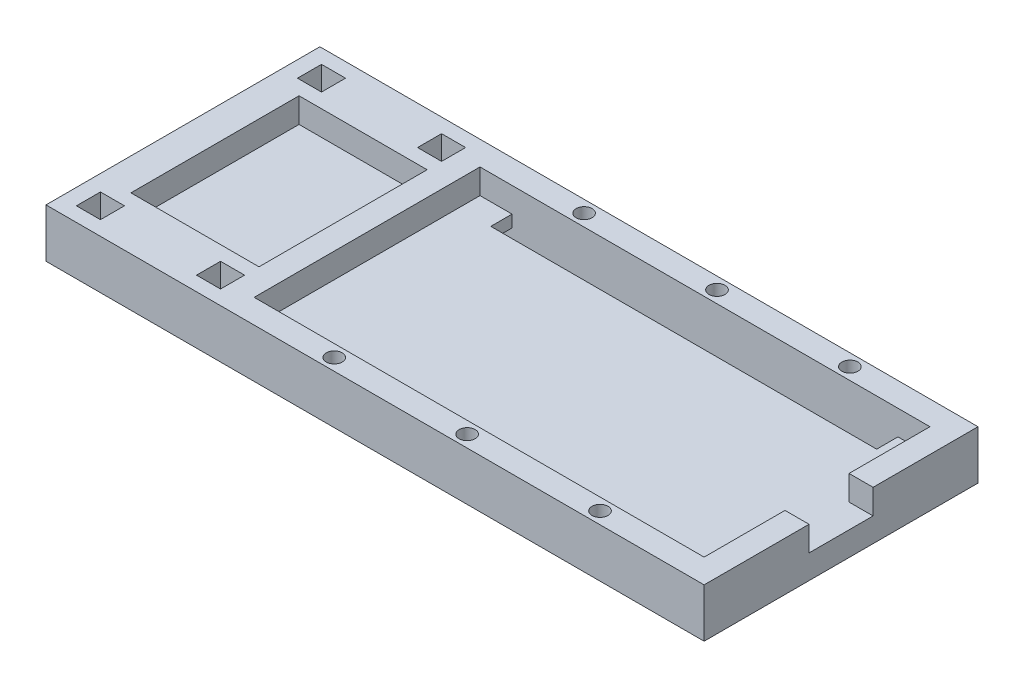
from build123d import *

# Parameters (mm, degrees)
SKETCH1_W            = 46.4
SKETCH1_H            = 24.75
BOSS_EXTRUDE1_DEPTH  = 5.9
BOSS_EXTRUDE2_DEPTH  = 2.5
SKETCH3_W            = 50
SKETCH3_H            = 50
BOSS_EXTRUDE3_DEPTH  = 2.5
SKETCH4_W            = 46.4
SKETCH4_H            = 0.93
BOSS_EXTRUDE4_DEPTH  = 5.9
SKETCH5_W            = 46.4
SKETCH5_H            = 0.93
BOSS_EXTRUDE5_DEPTH  = 5.9
SKETCH6_W            = 46.4
SKETCH6_H            = 3
BOSS_EXTRUDE6_DEPTH  = 8.4
SKETCH7_W            = 46.4
SKETCH7_H            = 3
BOSS_EXTRUDE7_DEPTH  = 8.4
SKETCH8_W            = 46.4
SKETCH8_H            = 22.9
BOSS_EXTRUDE8_DEPTH  = 8.4
SKETCH9_W            = 46.4
SKETCH9_H            = 3
BOSS_EXTRUDE9_DEPTH  = 8.4
SKETCH10_W           = 22.9
SKETCH10_H           = 10.9
BOSS_EXTRUDE10_DEPTH = 1.8
SKETCH11_W           = 0.93
SKETCH11_H           = 5.9
BOSS_EXTRUDE11_DEPTH = 1.8
SKETCH12_W           = 32.7
SKETCH12_H           = 0.925
SKETCH12_H_2         = 0.93
BOSS_EXTRUDE12_DEPTH = 8.4
SKETCH13_W           = 0.93
SKETCH13_H           = 5.9
BOSS_EXTRUDE13_DEPTH = 1.8
SKETCH14_W           = 48.2
SKETCH14_H           = 3
BOSS_EXTRUDE14_DEPTH = 8.4
SKETCH15_W           = 32.7
SKETCH15_H           = 0.93
SKETCH15_H_2         = 0.925
BOSS_EXTRUDE15_DEPTH = 8.4
SKETCH16_W           = 0.35
SKETCH16_H           = 5.9
CUT_EXTRUDE1_DEPTH   = 59.371568422
SKETCH18_W           = 0.35
SKETCH18_H           = 5.9
CUT_EXTRUDE2_DEPTH   = 59.371568422
SKETCH20_W           = 22.9
SKETCH20_H           = 2.5
BOSS_EXTRUDE17_DEPTH = 4
SKETCH22_W           = 22.9
SKETCH22_H           = 2.5
BOSS_EXTRUDE19_DEPTH = 3
SKETCH23_W           = 3
SKETCH23_H           = 22.9
BOSS_EXTRUDE20_DEPTH = 1.5
SKETCH24_W           = 22.9
SKETCH24_H           = 2.5
BOSS_EXTRUDE21_DEPTH = 7
SKETCH25_W           = 3
SKETCH25_H           = 22.9
BOSS_EXTRUDE22_DEPTH = 3
SKETCH27_W           = 48.2
SKETCH27_H           = 3
BOSS_EXTRUDE23_DEPTH = 7
SKETCH28_W           = 56.2
SKETCH28_H           = 22.9
BOSS_EXTRUDE24_DEPTH = 7
SKETCH29_W           = 3
SKETCH29_H           = 22.9
BOSS_EXTRUDE25_DEPTH = 7
SKETCH30_W           = 3
SKETCH30_H           = 22.9
BOSS_EXTRUDE26_DEPTH = 7
SKETCH31_W           = 7
SKETCH31_H           = 6.5
CUT_EXTRUDE3_DEPTH   = 56.415182938
SKETCH32_W           = 7
SKETCH32_H           = 6.5
CUT_EXTRUDE4_DEPTH   = 56.415182938
SKETCH33_W           = 2.66
SKETCH33_H           = 2.66
CUT_EXTRUDE5_DEPTH   = 67.259188042
SKETCH34_W           = 2.66
SKETCH34_H           = 2.66
CUT_EXTRUDE6_DEPTH   = 67.259188042
SKETCH35_W           = 3
SKETCH35_H           = 8
CUT_EXTRUDE7_DEPTH   = 3
SKETCH36_W           = 3
SKETCH36_H           = 22.9
BOSS_EXTRUDE27_DEPTH = 1.5
SKETCH38_W           = 48.2
SKETCH38_H           = 3
BOSS_EXTRUDE28_DEPTH = 3.1
SKETCH39_W           = 48.2
SKETCH39_H           = 3
BOSS_EXTRUDE29_DEPTH = 3.1
SKETCH40_W           = 3
SKETCH40_H           = 7.45
BOSS_EXTRUDE30_DEPTH = 0.1
SKETCH41_W           = 3
SKETCH41_H           = 22.9
BOSS_EXTRUDE31_DEPTH = 0.1
SKETCH43_W           = 3
SKETCH43_H           = 6.1
BOSS_EXTRUDE32_DEPTH = 5.655
SKETCH44_W           = 3
SKETCH44_H           = 6.1
BOSS_EXTRUDE33_DEPTH = 4
SKETCH45_W           = 3
SKETCH45_H           = 6.1
BOSS_EXTRUDE34_DEPTH = 5.655
SKETCH46_W           = 3
SKETCH46_H           = 6.1
BOSS_EXTRUDE35_DEPTH = 4
SKETCH47_W           = 3
SKETCH47_H           = 6.1
BOSS_EXTRUDE36_DEPTH = 5.655
SKETCH48_W           = 3
SKETCH48_H           = 6.1
BOSS_EXTRUDE37_DEPTH = 4
SKETCH49_W           = 3
SKETCH49_H           = 6.1
BOSS_EXTRUDE38_DEPTH = 5.655
SKETCH50_W           = 3
SKETCH50_H           = 6.1
BOSS_EXTRUDE39_DEPTH = 4
SKETCH51_W           = 34.21
SKETCH51_H           = 30.544600681
CUT_EXTRUDE9_DEPTH   = 67.29969834
SKETCH52_W           = 63.173752843
SKETCH52_H           = 8.017793163
CUT_EXTRUDE10_DEPTH  = 67.29969834
BOSS_EXTRUDE40_DEPTH = 6.1
SKETCH55_W           = 16
SKETCH55_H           = 21
BOSS_EXTRUDE41_DEPTH = 3
SKETCH56_W           = 2.66
SKETCH56_H           = 21
CUT_EXTRUDE11_DEPTH  = 54.124674352
SKETCH59_W           = 2.655
SKETCH59_H           = 3
BOSS_EXTRUDE44_DEPTH = 4
SKETCH60_W           = 2.655
SKETCH60_H           = 3
BOSS_EXTRUDE45_DEPTH = 4
SKETCH61_W           = 2.655
SKETCH61_H           = 3
BOSS_EXTRUDE46_DEPTH = 4
SKETCH62_W           = 2.655
SKETCH62_H           = 3
BOSS_EXTRUDE47_DEPTH = 4
SKETCH64_W           = 3
SKETCH64_H           = 3
CUT_EXTRUDE12_DEPTH  = 3
SKETCH42_R           = 1
CUT_EXTRUDE13_DEPTH  = 3
SKETCH65_W           = 2.66
SKETCH65_H           = 3.605
SKETCH65_W_2         = 7
SKETCH65_H_2         = 2.655
CUT_EXTRUDE14_DEPTH  = 1.5


with BuildPart() as part:
    # Sketch1 → Boss-Extrude1 (new body)
    with BuildSketch(Plane(origin=(0, 0, 0), x_dir=(1, 0, 0), z_dir=(0, 1, 0))):
        Rectangle(SKETCH1_W, SKETCH1_H)
    extrude(amount=BOSS_EXTRUDE1_DEPTH)

    # Sketch2 → Boss-Extrude2 (add)
    with BuildSketch(Plane(origin=(0, 5.9, 0), x_dir=(1, 0, 0), z_dir=(0, 1, 0))):
        Polygon((23.2, -11.45), (23.2, 0), (23.2, 11.45), (-23.2, 11.45), (-23.2, -11.45), align=None)
    extrude(amount=BOSS_EXTRUDE2_DEPTH)

    # Sketch3 → Boss-Extrude3 (add)
    with BuildSketch(Plane.XZ):
        Rectangle(SKETCH3_W, SKETCH3_H)
    extrude(amount=BOSS_EXTRUDE3_DEPTH)

    # Sketch4 → Boss-Extrude4 (add)
    with BuildSketch(Plane(origin=(0, 0, 0), x_dir=(1, 0, 0), z_dir=(0, 1, 0))):
        with Locations((0, 13.64)):
            Rectangle(SKETCH4_W, SKETCH4_H)
    extrude(amount=BOSS_EXTRUDE4_DEPTH)

    # Sketch5 → Boss-Extrude5 (add)
    with BuildSketch(Plane(origin=(0, 0, 0), x_dir=(1, 0, 0), z_dir=(0, 1, 0))):
        with Locations((0, -13.64)):
            Rectangle(SKETCH5_W, SKETCH5_H)
    extrude(amount=BOSS_EXTRUDE5_DEPTH)

    # Sketch6 → Boss-Extrude6 (add)
    with BuildSketch(Plane(origin=(0, 0, 0), x_dir=(1, 0, 0), z_dir=(0, 1, 0))):
        with Locations((0, 15.605)):
            Rectangle(SKETCH6_W, SKETCH6_H)
    extrude(amount=BOSS_EXTRUDE6_DEPTH)

    # Sketch7 → Boss-Extrude7 (add)
    with BuildSketch(Plane(origin=(0, 0, 0), x_dir=(1, 0, 0), z_dir=(0, 1, 0))):
        with Locations((0, -15.605)):
            Rectangle(SKETCH7_W, SKETCH7_H)
    extrude(amount=BOSS_EXTRUDE7_DEPTH)

    # Sketch8 → Boss-Extrude8 (add)
    with BuildSketch(Plane(origin=(0, 8.4, 0), x_dir=(1, 0, 0), z_dir=(0, 1, 0))):
        Rectangle(SKETCH8_W, SKETCH8_H)
    extrude(amount=BOSS_EXTRUDE8_DEPTH)

    # Sketch9 → Boss-Extrude9 (add)
    with BuildSketch(Plane(origin=(0, 8.4, 0), x_dir=(1, 0, 0), z_dir=(0, 1, 0))):
        with Locations((0, -15.605)):
            Rectangle(SKETCH9_W, SKETCH9_H)
    extrude(amount=BOSS_EXTRUDE9_DEPTH)

    # Sketch10 → Boss-Extrude10 (add)
    with BuildSketch(Plane(origin=(23.2, 0, 0), x_dir=(0, 0, -1), z_dir=(1, 0, 0))):
        with Locations((0, 11.35)):
            Rectangle(SKETCH10_W, SKETCH10_H)
        Polygon((-11.45, 5.9), (11.45, 5.9), (12.375, 5.9), (12.375, 0), (-12.375, 0), (-12.375, 5.9), align=None)
    extrude(amount=BOSS_EXTRUDE10_DEPTH)

    # Sketch11 → Boss-Extrude11 (add)
    with BuildSketch(Plane(origin=(23.2, 0, 0), x_dir=(0, 0, -1), z_dir=(1, 0, 0))):
        Polygon((-14.105, 16.8), (-17.105, 16.8), (-17.105, 0), (-14.105, 0), (-14.105, 5.9), align=None)
        with Locations((-13.64, 2.95)):
            Rectangle(SKETCH11_W, SKETCH11_H)
    extrude(amount=BOSS_EXTRUDE11_DEPTH)

    # Sketch12 → Boss-Extrude12 (add)
    with BuildSketch(Plane(origin=(0, 5.9, 0), x_dir=(1, 0, 0), z_dir=(0, 1, 0))):
        with Locations((-6.85, -11.9125)):
            Rectangle(SKETCH12_W, SKETCH12_H)
        with Locations((-6.85, -13.64)):
            Rectangle(SKETCH12_W, SKETCH12_H_2)
    extrude(amount=BOSS_EXTRUDE12_DEPTH)

    # Sketch13 → Boss-Extrude13 (add)
    with BuildSketch(Plane(origin=(23.2, 0, 0), x_dir=(0, 0, -1), z_dir=(1, 0, 0))):
        Polygon((17.105, 0), (17.105, 8.4), (14.105, 8.4), (14.105, 5.9), (14.105, 0), align=None)
        with Locations((13.64, 2.95)):
            Rectangle(SKETCH13_W, SKETCH13_H)
    extrude(amount=BOSS_EXTRUDE13_DEPTH)

    # Sketch14 → Boss-Extrude14 (add)
    with BuildSketch(Plane(origin=(0, 8.4, 0), x_dir=(1, 0, 0), z_dir=(0, 1, 0))):
        with Locations((0.9, 15.605)):
            Rectangle(SKETCH14_W, SKETCH14_H)
    extrude(amount=BOSS_EXTRUDE14_DEPTH)

    # Sketch15 → Boss-Extrude15 (add)
    with BuildSketch(Plane(origin=(0, 5.9, 0), x_dir=(1, 0, 0), z_dir=(0, 1, 0))):
        with Locations((8.65, 13.64)):
            Rectangle(SKETCH15_W, SKETCH15_H)
        with Locations((8.65, 11.9125)):
            Rectangle(SKETCH15_W, SKETCH15_H_2)
    extrude(amount=BOSS_EXTRUDE15_DEPTH)

    # Sketch16 → Cut-Extrude1 (cut, through all)
    with BuildSketch(Plane(origin=(25, 0, 0), x_dir=(0, 0, -1), z_dir=(1, 0, 0))):
        with Locations((-12.2, 2.95)):
            Rectangle(SKETCH16_W, SKETCH16_H)
        with Locations((-13.35, 2.95)):
            Rectangle(SKETCH16_W, SKETCH16_H)
    extrude(amount=-CUT_EXTRUDE1_DEPTH, mode=Mode.SUBTRACT)

    # Sketch18 → Cut-Extrude2 (cut, through all)
    with BuildSketch(Plane(origin=(25, 0, 0), x_dir=(0, 0, -1), z_dir=(1, 0, 0))):
        with Locations((12.2, 2.95)):
            Rectangle(SKETCH18_W, SKETCH18_H)
        with Locations((13.35, 2.95)):
            Rectangle(SKETCH18_W, SKETCH18_H)
    extrude(amount=-CUT_EXTRUDE2_DEPTH, mode=Mode.SUBTRACT)

    # Sketch20 → Boss-Extrude17 (add)
    with BuildSketch(Plane.ZY.offset(23.2)):
        with Locations((0, 15.55)):
            Rectangle(SKETCH20_W, SKETCH20_H)
    extrude(amount=BOSS_EXTRUDE17_DEPTH)

    # Sketch22 → Boss-Extrude19 (add)
    with BuildSketch(Plane.ZY.offset(27.2)):
        with Locations((0, 15.55)):
            Rectangle(SKETCH22_W, SKETCH22_H)
    extrude(amount=BOSS_EXTRUDE19_DEPTH)

    # Sketch23 → Boss-Extrude20 (add)
    with BuildSketch(Plane(origin=(0, 16.8, 0), x_dir=(1, 0, 0), z_dir=(0, 1, 0))):
        with Locations((-28.7, 0)):
            Rectangle(SKETCH23_W, SKETCH23_H)
    extrude(amount=BOSS_EXTRUDE20_DEPTH)

    # Sketch24 → Boss-Extrude21 (add)
    with BuildSketch(Plane(origin=(25, 0, 0), x_dir=(0, 0, -1), z_dir=(1, 0, 0))):
        with Locations((0, 15.55)):
            Rectangle(SKETCH24_W, SKETCH24_H)
    extrude(amount=BOSS_EXTRUDE21_DEPTH)

    # Sketch25 → Boss-Extrude22 (add)
    with BuildSketch(Plane(origin=(0, 16.8, 0), x_dir=(1, 0, 0), z_dir=(0, 1, 0))):
        with Locations((30.5, 0)):
            Rectangle(SKETCH25_W, SKETCH25_H)
    extrude(amount=BOSS_EXTRUDE22_DEPTH)

    # Sketch27 → Boss-Extrude23 (add)
    with BuildSketch(Plane(origin=(0, 16.8, 0), x_dir=(1, 0, 0), z_dir=(0, 1, 0))):
        with Locations((0.9, 15.605)):
            Rectangle(SKETCH27_W, SKETCH27_H)
        with Locations((0.9, -15.605)):
            Rectangle(SKETCH27_W, SKETCH27_H)
    extrude(amount=BOSS_EXTRUDE23_DEPTH)

    # Sketch28 → Boss-Extrude24 (add)
    with BuildSketch(Plane(origin=(0, 16.8, 0), x_dir=(1, 0, 0), z_dir=(0, 1, 0))):
        with Locations((0.9, 0)):
            Rectangle(SKETCH28_W, SKETCH28_H)
    extrude(amount=BOSS_EXTRUDE24_DEPTH)

    # Sketch29 → Boss-Extrude25 (add)
    with BuildSketch(Plane(origin=(0, 18.3, 0), x_dir=(1, 0, 0), z_dir=(0, 1, 0))):
        with Locations((-28.7, 0)):
            Rectangle(SKETCH29_W, SKETCH29_H)
    extrude(amount=BOSS_EXTRUDE25_DEPTH)

    # Sketch30 → Boss-Extrude26 (add)
    with BuildSketch(Plane(origin=(0, 19.8, 0), x_dir=(1, 0, 0), z_dir=(0, 1, 0))):
        with Locations((30.5, 0)):
            Rectangle(SKETCH30_W, SKETCH30_H)
    extrude(amount=BOSS_EXTRUDE26_DEPTH)

    # Sketch31 → Cut-Extrude3 (cut, through all)
    with BuildSketch(Plane(origin=(0, 0, -11.45), x_dir=(-1, 0, 0), z_dir=(0, 0, -1))):
        with Locations((26.7, 17.55)):
            Rectangle(SKETCH31_W, SKETCH31_H)
    extrude(amount=-CUT_EXTRUDE3_DEPTH, mode=Mode.SUBTRACT)

    # Sketch32 → Cut-Extrude4 (cut, through all)
    with BuildSketch(Plane.XY.offset(11.45)):
        with Locations((28.5, 17.55)):
            Rectangle(SKETCH32_W, SKETCH32_H)
    extrude(amount=-CUT_EXTRUDE4_DEPTH, mode=Mode.SUBTRACT)

    # Sketch33 → Cut-Extrude5 (cut, through all)
    with BuildSketch(Plane.ZY.offset(23.2)):
        with Locations((-12.775, 1.33)):
            Rectangle(SKETCH33_W, SKETCH33_H)
    extrude(amount=-CUT_EXTRUDE5_DEPTH, mode=Mode.SUBTRACT)

    # Sketch34 → Cut-Extrude6 (cut, through all)
    with BuildSketch(Plane.ZY.offset(23.2)):
        with Locations((12.775, 1.33)):
            Rectangle(SKETCH34_W, SKETCH34_H)
    extrude(amount=-CUT_EXTRUDE6_DEPTH, mode=Mode.SUBTRACT)

    # Sketch35 → Cut-Extrude7 (cut)
    with BuildSketch(Plane(origin=(0, 26.8, 0), x_dir=(1, 0, 0), z_dir=(0, 1, 0))):
        with Locations((30.5, 0)):
            Rectangle(SKETCH35_W, SKETCH35_H)
    extrude(amount=-CUT_EXTRUDE7_DEPTH, mode=Mode.SUBTRACT)

    # Sketch36 → Boss-Extrude27 (add)
    with BuildSketch(Plane(origin=(0, 25.3, 0), x_dir=(1, 0, 0), z_dir=(0, 1, 0))):
        with Locations((-28.7, 0)):
            Rectangle(SKETCH36_W, SKETCH36_H)
    extrude(amount=BOSS_EXTRUDE27_DEPTH)

    # Sketch38 → Boss-Extrude28 (add)
    with BuildSketch(Plane(origin=(0, 23.8, 0), x_dir=(1, 0, 0), z_dir=(0, 1, 0))):
        with Locations((0.9, -15.605)):
            Rectangle(SKETCH38_W, SKETCH38_H)
    extrude(amount=BOSS_EXTRUDE28_DEPTH)

    # Sketch39 → Boss-Extrude29 (add)
    with BuildSketch(Plane(origin=(0, 23.8, 0), x_dir=(1, 0, 0), z_dir=(0, 1, 0))):
        with Locations((0.9, 15.605)):
            Rectangle(SKETCH39_W, SKETCH39_H)
    extrude(amount=BOSS_EXTRUDE29_DEPTH)

    # Sketch40 → Boss-Extrude30 (add)
    with BuildSketch(Plane(origin=(0, 26.8, 0), x_dir=(1, 0, 0), z_dir=(0, 1, 0))):
        with Locations((30.5, 7.725)):
            Rectangle(SKETCH40_W, SKETCH40_H)
        with Locations((30.5, -7.725)):
            Rectangle(SKETCH40_W, SKETCH40_H)
    extrude(amount=BOSS_EXTRUDE30_DEPTH)

    # Sketch41 → Boss-Extrude31 (add)
    with BuildSketch(Plane(origin=(0, 26.8, 0), x_dir=(1, 0, 0), z_dir=(0, 1, 0))):
        with Locations((-28.7, 0)):
            Rectangle(SKETCH41_W, SKETCH41_H)
    extrude(amount=BOSS_EXTRUDE31_DEPTH)

    # Sketch43 → Boss-Extrude32 (add)
    with BuildSketch(Plane.XY.offset(11.45)):
        with Locations((-28.7, 23.85)):
            Rectangle(SKETCH43_W, SKETCH43_H)
    extrude(amount=BOSS_EXTRUDE32_DEPTH)

    # Sketch44 → Boss-Extrude33 (add)
    with BuildSketch(Plane(origin=(-27.2, 0, 0), x_dir=(0, 0, -1), z_dir=(1, 0, 0))):
        with Locations((-15.605, 23.85)):
            Rectangle(SKETCH44_W, SKETCH44_H)
    extrude(amount=BOSS_EXTRUDE33_DEPTH)

    # Sketch45 → Boss-Extrude34 (add)
    with BuildSketch(Plane(origin=(0, 0, -11.45), x_dir=(-1, 0, 0), z_dir=(0, 0, -1))):
        with Locations((28.7, 23.85)):
            Rectangle(SKETCH45_W, SKETCH45_H)
    extrude(amount=BOSS_EXTRUDE34_DEPTH)

    # Sketch46 → Boss-Extrude35 (add)
    with BuildSketch(Plane(origin=(-27.2, 0, 0), x_dir=(0, 0, -1), z_dir=(1, 0, 0))):
        with Locations((15.605, 23.85)):
            Rectangle(SKETCH46_W, SKETCH46_H)
    extrude(amount=BOSS_EXTRUDE35_DEPTH)

    # Sketch47 → Boss-Extrude36 (add)
    with BuildSketch(Plane(origin=(0, 0, -11.45), x_dir=(-1, 0, 0), z_dir=(0, 0, -1))):
        with Locations((-30.5, 23.85)):
            Rectangle(SKETCH47_W, SKETCH47_H)
    extrude(amount=BOSS_EXTRUDE36_DEPTH)

    # Sketch48 → Boss-Extrude37 (add)
    with BuildSketch(Plane.ZY.offset(-29)):
        with Locations((-15.605, 23.85)):
            Rectangle(SKETCH48_W, SKETCH48_H)
    extrude(amount=BOSS_EXTRUDE37_DEPTH)

    # Sketch49 → Boss-Extrude38 (add)
    with BuildSketch(Plane.XY.offset(11.45)):
        with Locations((30.5, 23.85)):
            Rectangle(SKETCH49_W, SKETCH49_H)
    extrude(amount=BOSS_EXTRUDE38_DEPTH)

    # Sketch50 → Boss-Extrude39 (add)
    with BuildSketch(Plane.ZY.offset(-29)):
        with Locations((15.605, 23.85)):
            Rectangle(SKETCH50_W, SKETCH50_H)
    extrude(amount=BOSS_EXTRUDE39_DEPTH)

    # Sketch51 → Cut-Extrude9 (cut, through all)
    with BuildSketch(Plane.ZY.offset(23.2)):
        with Locations((0, 5.527699659)):
            Rectangle(SKETCH51_W, SKETCH51_H)
    extrude(amount=-CUT_EXTRUDE9_DEPTH, mode=Mode.SUBTRACT)


with BuildPart() as cut_extrude9_piece_1:
    # of the separate pieces the step leaves, piece 1, a body of its own (cut_extrude9_pieces)
    add(part.part.solids().sort_by_distance((32, 20.8, 17.105))[0])

    # Sketch54 → Boss-Extrude40 (add)
    with BuildSketch(Plane.XZ.offset(-20.8)):
        Polygon((-46.2, 10.5), (-30.2, 10.5), (-30.2, 17.105), (-50.2, 17.105), (-50.2, -17.105), (-30.2, -17.105), (-30.2, -10.5), (-46.2, -10.5), align=None)
    extrude(amount=-BOSS_EXTRUDE40_DEPTH)

    # Sketch55 → Boss-Extrude41 (add)
    with BuildSketch(Plane.XZ.offset(-20.8)):
        with Locations((-38.2, 0)):
            Rectangle(SKETCH55_W, SKETCH55_H)
    extrude(amount=-BOSS_EXTRUDE41_DEPTH)

    # Sketch56 → Cut-Extrude11 (cut, through all)
    with BuildSketch(Plane(origin=(0, 23.8, 0), x_dir=(1, 0, 0), z_dir=(0, 1, 0))):
        with Locations((-31.53, 0)):
            Rectangle(SKETCH56_W, SKETCH56_H)
    extrude(amount=-CUT_EXTRUDE11_DEPTH, mode=Mode.SUBTRACT)

    # Sketch59 → Boss-Extrude44 (add)
    with BuildSketch(Plane(origin=(-27.2, 0, 0), x_dir=(0, 0, -1), z_dir=(1, 0, 0))):
        with Locations((12.7775, 22.3)):
            Rectangle(SKETCH59_W, SKETCH59_H)
    extrude(amount=BOSS_EXTRUDE44_DEPTH)

    # Sketch60 → Boss-Extrude45 (add)
    with BuildSketch(Plane(origin=(-27.2, 0, 0), x_dir=(0, 0, -1), z_dir=(1, 0, 0))):
        with Locations((-12.7775, 22.3)):
            Rectangle(SKETCH60_W, SKETCH60_H)
    extrude(amount=BOSS_EXTRUDE45_DEPTH)

    # Sketch61 → Boss-Extrude46 (add)
    with BuildSketch(Plane.ZY.offset(-29)):
        with Locations((-12.7775, 22.3)):
            Rectangle(SKETCH61_W, SKETCH61_H)
    extrude(amount=BOSS_EXTRUDE46_DEPTH)

    # Sketch62 → Boss-Extrude47 (add)
    with BuildSketch(Plane.ZY.offset(-29)):
        with Locations((12.7775, 22.3)):
            Rectangle(SKETCH62_W, SKETCH62_H)
    extrude(amount=BOSS_EXTRUDE47_DEPTH)

    # Sketch64 → Cut-Extrude12 (cut)
    with BuildSketch(Plane(origin=(0, 26.9, 0), x_dir=(1, 0, 0), z_dir=(0, 1, 0))):
        with Locations((-46.7, 13.805)):
            Rectangle(SKETCH64_W, SKETCH64_H)
        with Locations((-46.7, -13.805)):
            Rectangle(SKETCH64_W, SKETCH64_H)
        with Locations((-31.7, 13.805)):
            Rectangle(SKETCH64_W, SKETCH64_H)
        with Locations((-31.7, -13.805)):
            Rectangle(SKETCH64_W, SKETCH64_H)
    extrude(amount=-CUT_EXTRUDE12_DEPTH, mode=Mode.SUBTRACT)

    # Sketch42 → Cut-Extrude13 (cut)
    with BuildSketch(Plane(origin=(0, 26.9, 0), x_dir=(1, 0, 0), z_dir=(0, 1, 0))):
        with Locations(Location((-15.7, -15.605, 0), (0, 0, 270))):
            Circle(SKETCH42_R)
        with Locations(Location((-15.7, 15.605, 0), (0, 0, 270))):
            Circle(SKETCH42_R)
        with Locations(Location((17.5, -15.605, 0), (0, 0, 270))):
            Circle(SKETCH42_R)
        with Locations(Location((17.5, 15.605, 0), (0, 0, 270))):
            Circle(SKETCH42_R)
        with Locations(Location((0.9, -15.605, 0), (0, 0, 270))):
            Circle(SKETCH42_R)
        with Locations(Location((0.9, 15.605, 0), (0, 0, 270))):
            Circle(SKETCH42_R)
    extrude(amount=-CUT_EXTRUDE13_DEPTH, mode=Mode.SUBTRACT)

    # Sketch65 → Cut-Extrude14 (cut)
    with BuildSketch(Plane.XZ.offset(-20.8)):
        with Locations((-31.53, 12.3025)):
            Rectangle(SKETCH65_W, SKETCH65_H)
        with Locations((-26.7, 12.7775)):
            Rectangle(SKETCH65_W_2, SKETCH65_H_2)
        with Locations((-31.53, -12.3025)):
            Rectangle(SKETCH65_W, SKETCH65_H)
        with Locations((-26.7, -12.7775)):
            Rectangle(SKETCH65_W_2, SKETCH65_H_2)
    extrude(amount=-CUT_EXTRUDE14_DEPTH, mode=Mode.SUBTRACT)


with BuildPart() as cut_extrude9_piece_2:
    # of the separate pieces the step leaves, piece 2, a body of its own (cut_extrude9_pieces)
    add(part.part.solids().sort_by_distance((-25, 0, 25))[0])

    # Sketch52 → Cut-Extrude10 (cut, through all)
    with BuildSketch(Plane(origin=(25, 0, 0), x_dir=(0, 0, -1), z_dir=(1, 0, 0))):
        with Locations((0.957814421, 0.092594216)):
            Rectangle(SKETCH52_W, SKETCH52_H)
    extrude(amount=-CUT_EXTRUDE10_DEPTH, mode=Mode.SUBTRACT)


solid = cut_extrude9_piece_1.part
